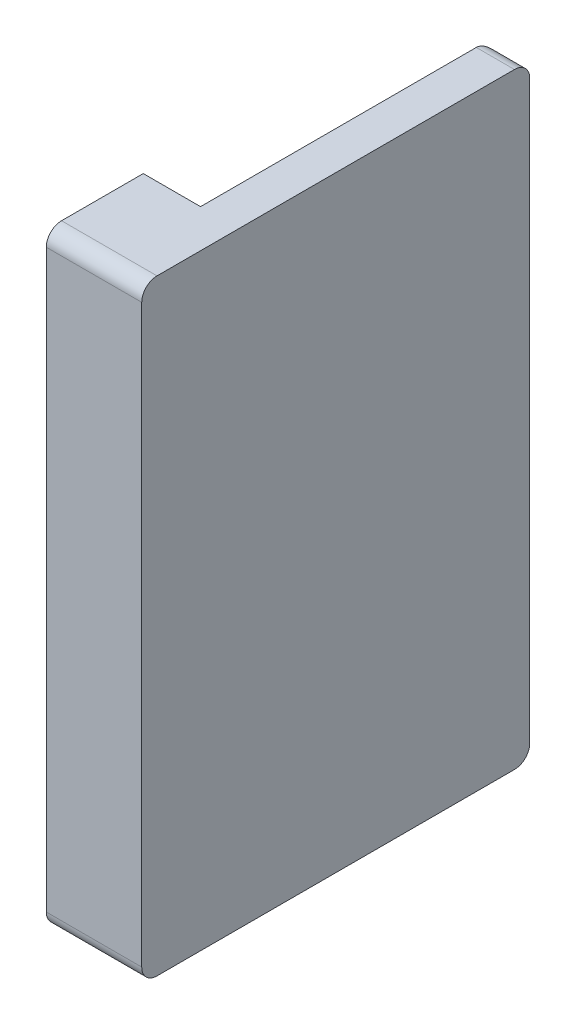
from build123d import *

# Parameters (mm, degrees)
SKETCH1_W           = 7.5
SKETCH1_H           = 12.7
BOSS_EXTRUDE1_DEPTH = 79.375
FILLET1_R           = 2


with BuildPart() as part:
    # Sketch1 → Boss-Extrude1 (new body)
    with BuildSketch(Plane(origin=(0, 0, 0), x_dir=(1, 0, 0), z_dir=(0, 1, 0))):
        with Locations((3.75, 6.35)):
            Rectangle(SKETCH1_W, SKETCH1_H)
        Polygon((7.5, 12.7), (7.5, 0), (12.5, 0), (12.5, 50.8), (7.5, 50.8), align=None)
    extrude(amount=BOSS_EXTRUDE1_DEPTH)

    # Fillet1
    fillet1_edges = [part.edges().sort_by_distance(p)[0] for p in [
        (6.25, 0, 0),
        (7.5, 39.6875, -50.8),
        (10, 79.375, -50.8),
        (6.25, 79.375, 0),
        (10, 0, -50.8),
    ]]
    fillet(fillet1_edges, radius=FILLET1_R)


solid = part.part
